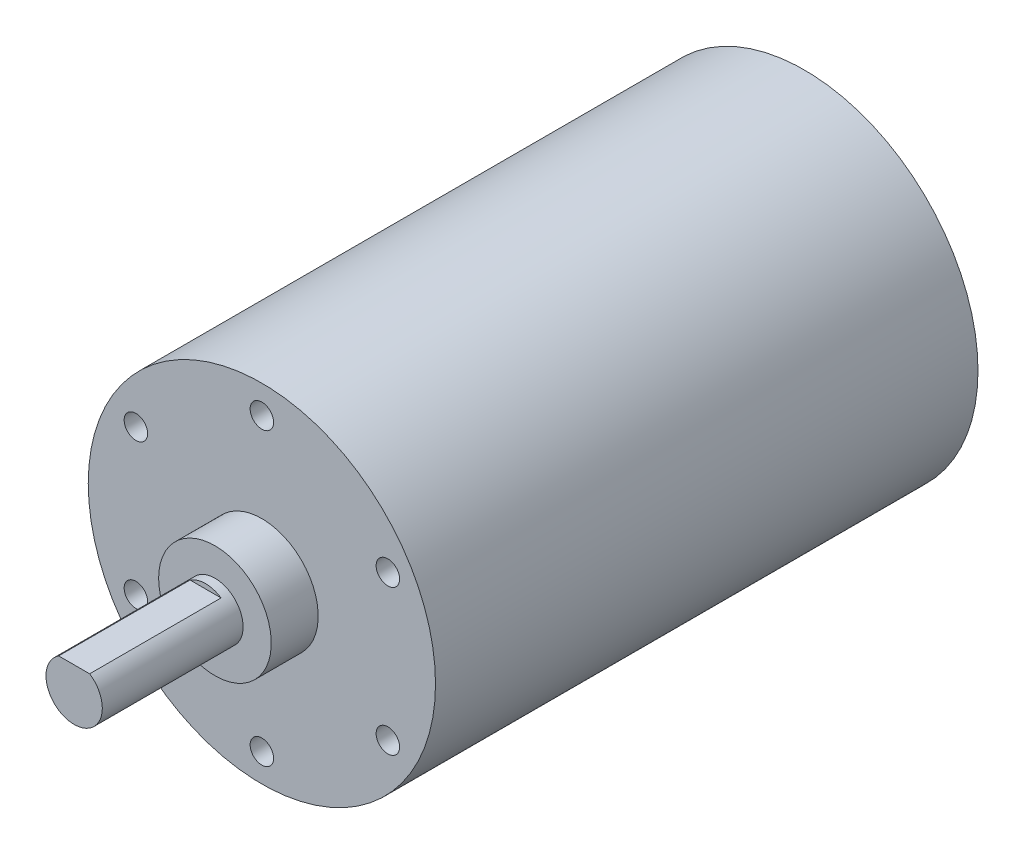
from build123d import *

# Parameters (mm, degrees)
SKETCH3_R           = 18.499963
BOSS_EXTRUDE1_DEPTH = 57.8000114
SKETCH4_R           = 2.999994
BOSS_EXTRUDE2_DEPTH = 20.00001334
SKETCH6_R           = 6.0000007
BOSS_EXTRUDE3_DEPTH = 5.0000154
SKETCH8_R           = 1.25000004
CUT_EXTRUDE3_DEPTH  = 8.89
SKETCH7_W           = 3.305573972
SKETCH7_H           = 0.499999
CUT_EXTRUDE4_DEPTH  = 13.9999974


with BuildPart() as part:
    # Sketch3 → Boss-Extrude1 (new body)
    with BuildSketch(Plane.XY):
        Circle(SKETCH3_R)
    extrude(amount=-BOSS_EXTRUDE1_DEPTH)

    # Sketch4 → Boss-Extrude2 (add)
    with BuildSketch(Plane.XY):
        Circle(SKETCH4_R)
    extrude(amount=BOSS_EXTRUDE2_DEPTH)

    # Sketch6 → Boss-Extrude3 (add)
    with BuildSketch(Plane.XY):
        with Locations(Location((0, 0, 0), (0, 0, 180))):
            Circle(SKETCH6_R)
    extrude(amount=BOSS_EXTRUDE3_DEPTH)

    # Sketch8 → Cut-Extrude3 (cut)
    with BuildSketch(Plane.XY):
        with Locations((0, 15.499969)):
            Circle(SKETCH8_R)
        with Locations((13.423366912, 7.7499845)):
            Circle(SKETCH8_R)
        with Locations((13.423366912, -7.7499845)):
            Circle(SKETCH8_R)
        with Locations((0, -15.499969)):
            Circle(SKETCH8_R)
        with Locations((-13.423366912, -7.7499845)):
            Circle(SKETCH8_R)
        with Locations((-13.423366912, 7.7499845)):
            Circle(SKETCH8_R)
    extrude(amount=-CUT_EXTRUDE3_DEPTH, mode=Mode.SUBTRACT)

    # Sketch7 → Cut-Extrude4 (cut)
    with BuildSketch(Plane.XY.offset(20.00001334)):
        with Locations((0, 2.753648673)):
            Rectangle(SKETCH7_W, SKETCH7_H)
    extrude(amount=-CUT_EXTRUDE4_DEPTH, mode=Mode.SUBTRACT)


solid = part.part
